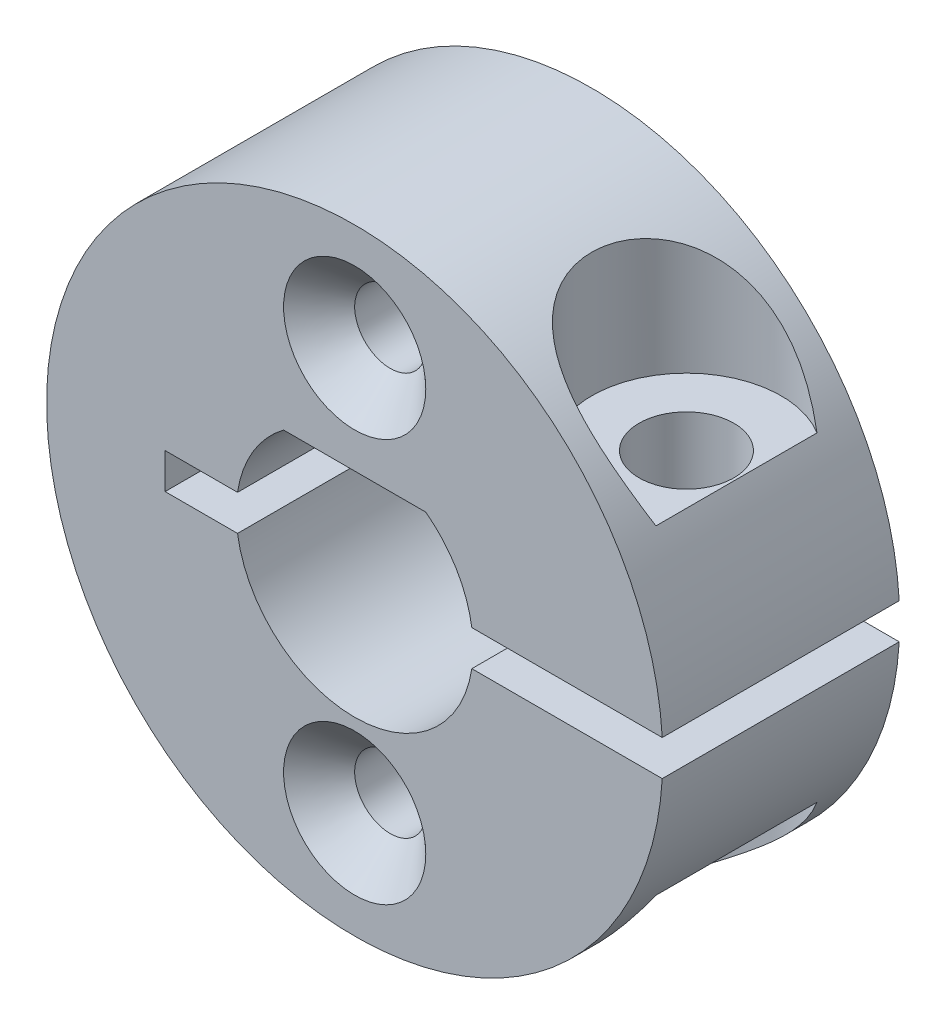
from build123d import *

# Parameters (mm, degrees)
SKETCH_1_R               = 13
SKETCH_1_R_2             = 1.5
EXTRUDE_1_DEPTH          = 10
CUT_EXTRUDE_1_DEPTH      = 21.928449536
CUT_EXTRUDE_1_DEPTH_BACK = 21.928449536
SKETCH_2_R               = 2
CUT_EXTRUDE_START        = -10
CUT_EXTRUDE_2_DEPTH      = 10
CHAMFER_1_SIZE           = 1.5
CUT_EXTRUDE_START_2      = -29.045721762
SKETCH_4_R               = 4
CUT_EXTRUDE_6_DEPTH      = 32.045721762


with BuildPart() as part:
    # 草图1 → 凸台-拉伸1 (new body)
    with BuildSketch(Plane.XY):
        Circle(SKETCH_1_R)
        with Locations((0, 8.5)):
            Circle(SKETCH_1_R_2, mode=Mode.SUBTRACT)
        with Locations((0, -8.5)):
            Circle(SKETCH_1_R_2, mode=Mode.SUBTRACT)
        with BuildLine():
            Line((-3, 4), (3, 4))
            ThreePointArc((3, 4), (0, -5), (-3, 4))
        make_face(mode=Mode.SUBTRACT)
    extrude(amount=EXTRUDE_1_DEPTH)

    # 草图2 → 切除-拉伸1 (cut, two sides: drawn at the far end of the back side and taken through both)
    with BuildSketch(Plane(origin=(0, 0, 0), x_dir=(1, 0, 0), z_dir=(0, 1, 0)).offset(-CUT_EXTRUDE_1_DEPTH_BACK)):
        with Locations(Location((9, -5, 0), (0, 0, 270))):
            Circle(SKETCH_2_R)
    extrude(amount=CUT_EXTRUDE_1_DEPTH + CUT_EXTRUDE_1_DEPTH_BACK, mode=Mode.SUBTRACT)

    # 草图3 → 切除-拉伸2 (cut)
    with BuildSketch(Plane.XY.offset(10).offset(CUT_EXTRUDE_START)):
        with BuildLine():
            Line((4.943429983, 0.75), (-4.943429983, 0.75))
            ThreePointArc((-4.943429983, 0.75), (-5, 0), (-4.943429983, -0.75))
            Line((-4.943429983, -0.75), (4.943429983, -0.75))
            ThreePointArc((4.943429983, -0.75), (5, 0), (4.943429983, 0.75))
        make_face()
        with BuildLine():
            Line((-4.943429983, 0.75), (-8, 0.75))
            Line((-8, 0.75), (-8, -0.75))
            Line((-8, -0.75), (-4.943429983, -0.75))
            ThreePointArc((-4.943429983, -0.75), (-5, 0), (-4.943429983, 0.75))
        make_face()
        with BuildLine():
            ThreePointArc((13, 0), (12.994585711, 0.375156246), (12.978347352, 0.75))
            Line((12.978347352, 0.75), (4.943429983, 0.75))
            ThreePointArc((4.943429983, 0.75), (5, 0), (4.943429983, -0.75))
            Line((4.943429983, -0.75), (12.978347352, -0.75))
            ThreePointArc((12.978347352, -0.75), (12.994585711, -0.375156246), (13, 0))
        make_face()
        with BuildLine():
            Line((14.469834156, 0.75), (12.978347352, 0.75))
            ThreePointArc((12.978347352, 0.75), (12.994585711, 0.375156246), (13, 0))
            ThreePointArc((13, 0), (12.994585711, -0.375156246), (12.978347352, -0.75))
            Line((12.978347352, -0.75), (14.469834156, -0.75))
            Line((14.469834156, -0.75), (14.469834156, 0.75))
        make_face()
    extrude(amount=CUT_EXTRUDE_2_DEPTH, mode=Mode.SUBTRACT)

    # 倒角1
    chamfer_1_edges = [part.edges().sort_by_distance(p)[0] for p in [
        (-1.5, -8.5, 10),
        (-1.5, 8.5, 10),
    ]]
    chamfer(chamfer_1_edges, length=CHAMFER_1_SIZE)

    # 草图4 → 切除-拉伸6 (cut)
    with BuildSketch(Plane(origin=(0, 9.75, 0), x_dir=(-1, 0, 0), z_dir=(0, -1, 0)).offset(CUT_EXTRUDE_START_2)):
        with Locations((-9, -5)):
            Circle(SKETCH_4_R)
    cut_extrude_6 = extrude(amount=CUT_EXTRUDE_6_DEPTH, mode=Mode.SUBTRACT)

    # 镜向1: 切除-拉伸6 across plane
    add(cut_extrude_6.mirror(Plane.ZX), mode=Mode.SUBTRACT)


solid = part.part
